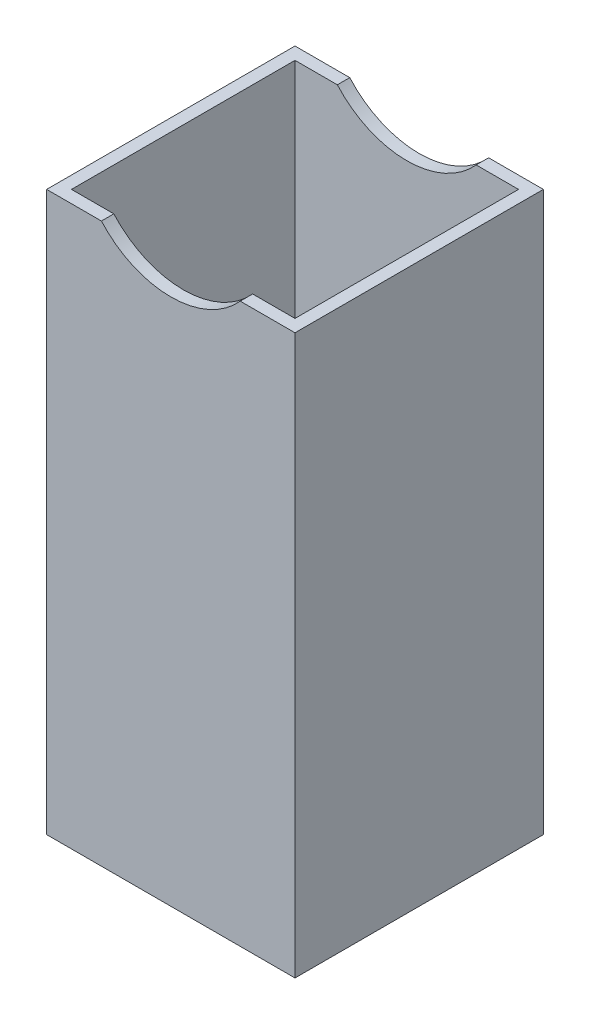
from build123d import *

# Parameters (mm, degrees)
ESBO_O1_W             = 40
ESBO_O1_H             = 40
ESBO_O1_W_2           = 36
ESBO_O1_H_2           = 36
ESBO_O3_R             = 15
CORTE_EXTRUS_O1_DEPTH = 50


with BuildPart() as part:
    # Varredura1: sweep along a path in Esboço2
    with BuildLine(Plane(origin=(0, 0, 0), x_dir=(0, 0, -1), z_dir=(1, 0, 0))) as varredura1_path:
        Line((0, 0), (0, -90))
    # Esboço1 → Varredura1 (sweep)
    with BuildSketch(Plane(origin=(0, 0, 0), x_dir=(1, 0, 0), z_dir=(0, 1, 0))):
        Rectangle(ESBO_O1_W, ESBO_O1_H)
        Rectangle(ESBO_O1_W_2, ESBO_O1_H_2, mode=Mode.SUBTRACT)
    sweep(path=varredura1_path.line)

    # Esboço3 → Corte-extrusão1 (cut)
    with BuildSketch(Plane.XY.offset(20)):
        with Locations((0, 10)):
            Circle(ESBO_O3_R)
    extrude(amount=-CORTE_EXTRUS_O1_DEPTH, mode=Mode.SUBTRACT)


solid = part.part
